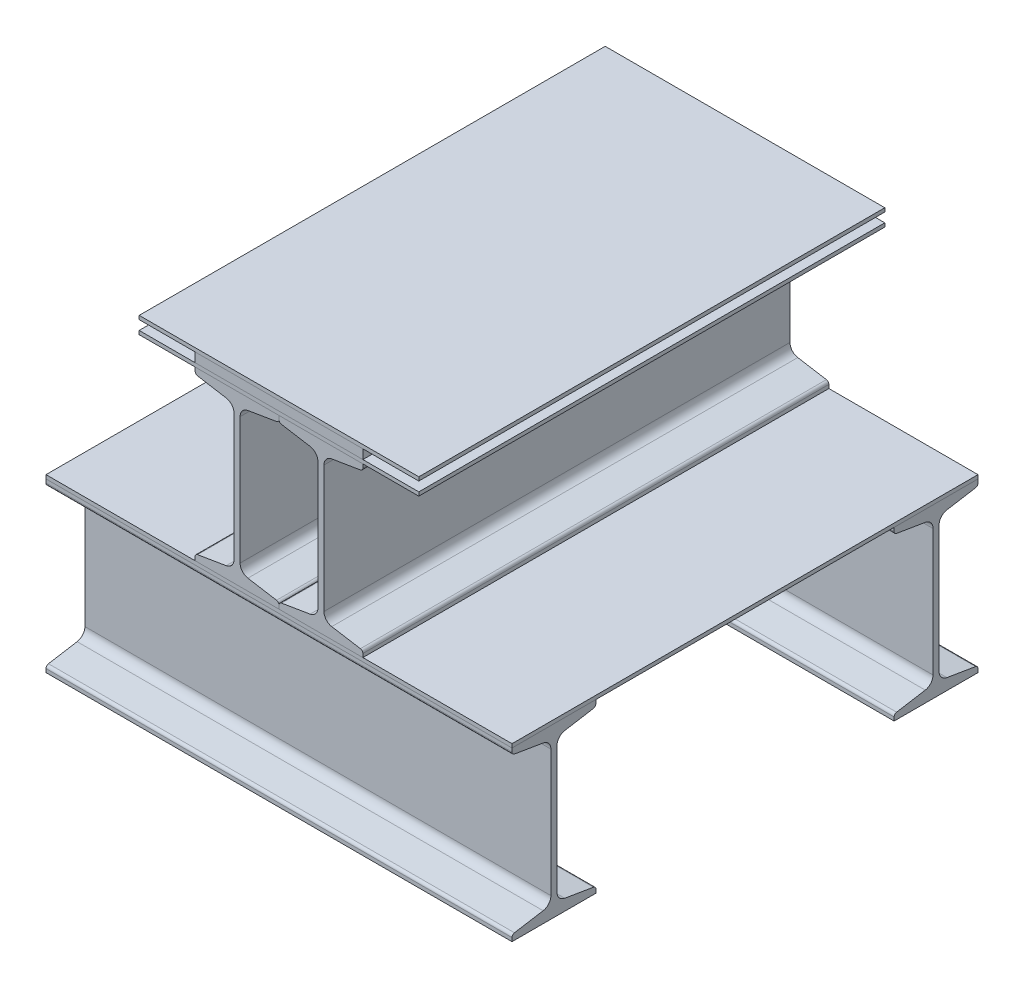
from build123d import *

# Parameters (mm, degrees)
SB_BEAM_SB_180_X_23_1_DEPTH = 500
SB_BEAM_SB_180_X_23_2_DEPTH = 500
SKETCH1_W                   = 500
SKETCH1_H                   = 500
BOSS_EXTRUDE1_DEPTH         = 4
SB_BEAM_SB_180_X_23_3_DEPTH = 500
SB_BEAM_SB_180_X_23_4_DEPTH = 500
BOSS_EXTRUDE2_START         = 180
SKETCH132_W                 = 60
SKETCH132_H                 = 500
SKETCH132_W_2               = 180
BOSS_EXTRUDE2_DEPTH         = 4
BOSS_EXTRUDE3_START         = 184
SKETCH132_3_W               = 180
SKETCH132_3_H               = 500
BOSS_EXTRUDE3_DEPTH         = 10
BOSS_EXTRUDE4_START         = 194
SKETCH132_4_W               = 180
SKETCH132_4_H               = 500
SKETCH132_4_W_2             = 60
BOSS_EXTRUDE4_DEPTH         = 4


with BuildPart() as part:
    # Sketch125 → Sb beam SB 180 X 23(1) (new body)
    with BuildSketch(Plane(origin=(0, -90, 45), x_dir=(0, 0, -1), z_dir=(1, 0, 0))):
        with BuildLine():
            Line((-45, -90), (-45, -86.169016721))
            ThreePointArc((-45, -86.169016721), (-44.247600583, -84.116790755), (-42.347003833, -83.037222188))
            Line((-42.347003833, -83.037222188), (-11.60589344, -77.913330028))
            ThreePointArc((-11.60589344, -77.913330028), (-5.619761943, -74.513114068), (-3.25, -68.049410239))
            Line((-3.25, -68.049410239), (-3.25, 68.049410239))
            ThreePointArc((-3.25, 68.049410239), (-5.619761943, 74.513114068), (-11.60589344, 77.913330028))
            Line((-11.60589344, 77.913330028), (-42.347003833, 83.037222188))
            ThreePointArc((-42.347003833, 83.037222188), (-44.247600583, 84.116790755), (-45, 86.169016721))
            Line((-45, 86.169016721), (-45, 90))
            Line((-45, 90), (45, 90))
            Line((45, 90), (45, 86.169016721))
            ThreePointArc((45, 86.169016721), (44.247600583, 84.116790755), (42.347003833, 83.037222188))
            Line((42.347003833, 83.037222188), (11.60589344, 77.913330028))
            ThreePointArc((11.60589344, 77.913330028), (5.619761943, 74.513114068), (3.25, 68.049410239))
            Line((3.25, 68.049410239), (3.25, -68.049410239))
            ThreePointArc((3.25, -68.049410239), (5.619761943, -74.513114068), (11.60589344, -77.913330028))
            Line((11.60589344, -77.913330028), (42.347003833, -83.037222188))
            ThreePointArc((42.347003833, -83.037222188), (44.247600583, -84.116790755), (45, -86.169016721))
            Line((45, -86.169016721), (45, -90))
            Line((45, -90), (-45, -90))
        make_face()
    extrude(amount=SB_BEAM_SB_180_X_23_1_DEPTH)


with BuildPart() as body_2:
    # Sketch127 → Sb beam SB 180 X 23(2) (new body)
    with BuildSketch(Plane(origin=(0, -90, 455), x_dir=(0, 0, -1), z_dir=(1, 0, 0))):
        with BuildLine():
            Line((-45, -90), (-45, -86.169016721))
            ThreePointArc((-45, -86.169016721), (-44.247600583, -84.116790755), (-42.347003833, -83.037222188))
            Line((-42.347003833, -83.037222188), (-11.60589344, -77.913330028))
            ThreePointArc((-11.60589344, -77.913330028), (-5.619761943, -74.513114068), (-3.25, -68.049410239))
            Line((-3.25, -68.049410239), (-3.25, 68.049410239))
            ThreePointArc((-3.25, 68.049410239), (-5.619761943, 74.513114068), (-11.60589344, 77.913330028))
            Line((-11.60589344, 77.913330028), (-42.347003833, 83.037222188))
            ThreePointArc((-42.347003833, 83.037222188), (-44.247600583, 84.116790755), (-45, 86.169016721))
            Line((-45, 86.169016721), (-45, 90))
            Line((-45, 90), (45, 90))
            Line((45, 90), (45, 86.169016721))
            ThreePointArc((45, 86.169016721), (44.247600583, 84.116790755), (42.347003833, 83.037222188))
            Line((42.347003833, 83.037222188), (11.60589344, 77.913330028))
            ThreePointArc((11.60589344, 77.913330028), (5.619761943, 74.513114068), (3.25, 68.049410239))
            Line((3.25, 68.049410239), (3.25, -68.049410239))
            ThreePointArc((3.25, -68.049410239), (5.619761943, -74.513114068), (11.60589344, -77.913330028))
            Line((11.60589344, -77.913330028), (42.347003833, -83.037222188))
            ThreePointArc((42.347003833, -83.037222188), (44.247600583, -84.116790755), (45, -86.169016721))
            Line((45, -86.169016721), (45, -90))
            Line((45, -90), (-45, -90))
        make_face()
    extrude(amount=SB_BEAM_SB_180_X_23_2_DEPTH)


with BuildPart() as body_3:
    # Sketch1 → Boss-Extrude1 (new body)
    with BuildSketch(Plane(origin=(0, 0, 0), x_dir=(1, 0, 0), z_dir=(0, 1, 0))):
        with Locations((250, -250)):
            Rectangle(SKETCH1_W, SKETCH1_H)
    extrude(amount=BOSS_EXTRUDE1_DEPTH)


with BuildPart() as body_4:
    # Sketch129 → Sb beam SB 180 X 23(3) (new body)
    with BuildSketch(Plane(origin=(295, 94, 0), x_dir=(1, 0, 0), z_dir=(0, 0, 1))):
        with BuildLine():
            Line((-45, -90), (-45, -86.169016721))
            ThreePointArc((-45, -86.169016721), (-44.247600583, -84.116790755), (-42.347003833, -83.037222188))
            Line((-42.347003833, -83.037222188), (-11.60589344, -77.913330028))
            ThreePointArc((-11.60589344, -77.913330028), (-5.619761943, -74.513114068), (-3.25, -68.049410239))
            Line((-3.25, -68.049410239), (-3.25, 68.049410239))
            ThreePointArc((-3.25, 68.049410239), (-5.619761943, 74.513114068), (-11.60589344, 77.913330028))
            Line((-11.60589344, 77.913330028), (-42.347003833, 83.037222188))
            ThreePointArc((-42.347003833, 83.037222188), (-44.247600583, 84.116790755), (-45, 86.169016721))
            Line((-45, 86.169016721), (-45, 90))
            Line((-45, 90), (45, 90))
            Line((45, 90), (45, 86.169016721))
            ThreePointArc((45, 86.169016721), (44.247600583, 84.116790755), (42.347003833, 83.037222188))
            Line((42.347003833, 83.037222188), (11.60589344, 77.913330028))
            ThreePointArc((11.60589344, 77.913330028), (5.619761943, 74.513114068), (3.25, 68.049410239))
            Line((3.25, 68.049410239), (3.25, -68.049410239))
            ThreePointArc((3.25, -68.049410239), (5.619761943, -74.513114068), (11.60589344, -77.913330028))
            Line((11.60589344, -77.913330028), (42.347003833, -83.037222188))
            ThreePointArc((42.347003833, -83.037222188), (44.247600583, -84.116790755), (45, -86.169016721))
            Line((45, -86.169016721), (45, -90))
            Line((45, -90), (-45, -90))
        make_face()
    extrude(amount=SB_BEAM_SB_180_X_23_3_DEPTH)


with BuildPart() as body_5:
    # Sketch131 → Sb beam SB 180 X 23(4) (new body)
    with BuildSketch(Plane(origin=(205, 94, 0), x_dir=(1, 0, 0), z_dir=(0, 0, 1))):
        with BuildLine():
            Line((-45, -90), (-45, -86.169016721))
            ThreePointArc((-45, -86.169016721), (-44.247600583, -84.116790755), (-42.347003833, -83.037222188))
            Line((-42.347003833, -83.037222188), (-11.60589344, -77.913330028))
            ThreePointArc((-11.60589344, -77.913330028), (-5.619761943, -74.513114068), (-3.25, -68.049410239))
            Line((-3.25, -68.049410239), (-3.25, 68.049410239))
            ThreePointArc((-3.25, 68.049410239), (-5.619761943, 74.513114068), (-11.60589344, 77.913330028))
            Line((-11.60589344, 77.913330028), (-42.347003833, 83.037222188))
            ThreePointArc((-42.347003833, 83.037222188), (-44.247600583, 84.116790755), (-45, 86.169016721))
            Line((-45, 86.169016721), (-45, 90))
            Line((-45, 90), (45, 90))
            Line((45, 90), (45, 86.169016721))
            ThreePointArc((45, 86.169016721), (44.247600583, 84.116790755), (42.347003833, 83.037222188))
            Line((42.347003833, 83.037222188), (11.60589344, 77.913330028))
            ThreePointArc((11.60589344, 77.913330028), (5.619761943, 74.513114068), (3.25, 68.049410239))
            Line((3.25, 68.049410239), (3.25, -68.049410239))
            ThreePointArc((3.25, -68.049410239), (5.619761943, -74.513114068), (11.60589344, -77.913330028))
            Line((11.60589344, -77.913330028), (42.347003833, -83.037222188))
            ThreePointArc((42.347003833, -83.037222188), (44.247600583, -84.116790755), (45, -86.169016721))
            Line((45, -86.169016721), (45, -90))
            Line((45, -90), (-45, -90))
        make_face()
    extrude(amount=SB_BEAM_SB_180_X_23_4_DEPTH)


with BuildPart() as body_6:
    # Sketch132 → Boss-Extrude2 (new body)
    with BuildSketch(Plane(origin=(0, 4, 0), x_dir=(1, 0, 0), z_dir=(0, 1, 0)).offset(BOSS_EXTRUDE2_START)):
        with Locations((130, -250)):
            Rectangle(SKETCH132_W, SKETCH132_H)
        with Locations((370, -250)):
            Rectangle(SKETCH132_W, SKETCH132_H)
        with Locations((250, -250)):
            Rectangle(SKETCH132_W_2, SKETCH132_H)
    extrude(amount=BOSS_EXTRUDE2_DEPTH)


with BuildPart() as body_7:
    # Sketch132<3> → Boss-Extrude3 (new body)
    with BuildSketch(Plane(origin=(0, 4, 0), x_dir=(1, 0, 0), z_dir=(0, 1, 0)).offset(BOSS_EXTRUDE3_START)):
        with Locations((250, -250)):
            Rectangle(SKETCH132_3_W, SKETCH132_3_H)
    extrude(amount=BOSS_EXTRUDE3_DEPTH)


with BuildPart() as body_8:
    # Sketch132<4> → Boss-Extrude4 (new body)
    with BuildSketch(Plane(origin=(0, 4, 0), x_dir=(1, 0, 0), z_dir=(0, 1, 0)).offset(BOSS_EXTRUDE4_START)):
        with Locations((250, -250)):
            Rectangle(SKETCH132_4_W, SKETCH132_4_H)
        with Locations((370, -250)):
            Rectangle(SKETCH132_4_W_2, SKETCH132_4_H)
        with Locations((130, -250)):
            Rectangle(SKETCH132_4_W_2, SKETCH132_4_H)
    extrude(amount=BOSS_EXTRUDE4_DEPTH)


solid = Compound([part.part, body_2.part, body_3.part, body_4.part, body_5.part, body_6.part, body_7.part, body_8.part])
